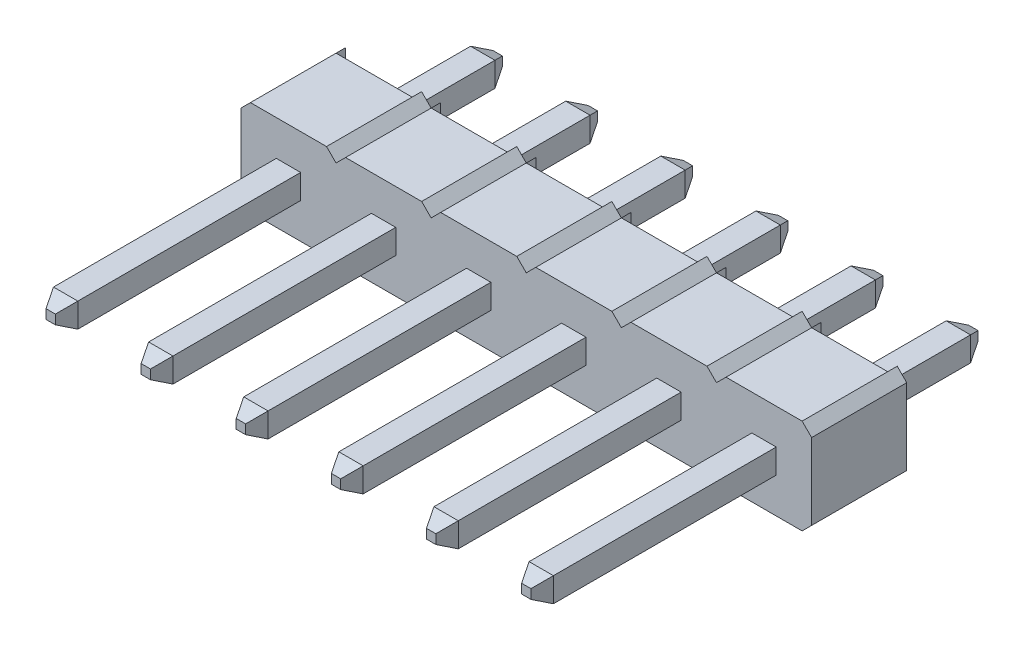
from build123d import *
from OCP.BRepFilletAPI import BRepFilletAPI_MakeChamfer

# Parameters (mm, degrees)
BOSS_EXTRUDE1_DEPTH  = 2.286
BOSS_EXTRUDE2_DEPTH  = 0.254
BOSS_EXTRUDE3_DEPTH  = 0.254
BOSS_EXTRUDE4_DEPTH  = 0.254
BOSS_EXTRUDE5_DEPTH  = 0.254
BOSS_EXTRUDE6_DEPTH  = 0.254
BOSS_EXTRUDE7_DEPTH  = 0.254
BOSS_EXTRUDE8_DEPTH  = 0.254
SKETCH9_W            = 0.65
SKETCH9_H            = 0.65
BOSS_EXTRUDE9_DEPTH  = 3.302
SKETCH10_W           = 0.65
SKETCH10_H           = 0.65
BOSS_EXTRUDE10_DEPTH = 6.35
SKETCH11_W           = 0.65
SKETCH11_H           = 0.65
BOSS_EXTRUDE11_DEPTH = 3.302
SKETCH12_W           = 0.65
SKETCH12_H           = 0.65
BOSS_EXTRUDE12_DEPTH = 6.35
SKETCH13_W           = 0.65
SKETCH13_H           = 0.65
BOSS_EXTRUDE13_DEPTH = 3.302
SKETCH14_W           = 0.65
SKETCH14_H           = 0.65
BOSS_EXTRUDE14_DEPTH = 6.35
SKETCH15_W           = 0.65
SKETCH15_H           = 0.65
BOSS_EXTRUDE15_DEPTH = 3.302
SKETCH16_W           = 0.65
SKETCH16_H           = 0.65
BOSS_EXTRUDE16_DEPTH = 6.35
SKETCH17_W           = 0.65
SKETCH17_H           = 0.65
BOSS_EXTRUDE17_DEPTH = 3.302
SKETCH18_W           = 0.65
SKETCH18_H           = 0.65
BOSS_EXTRUDE18_DEPTH = 6.35
SKETCH19_W           = 0.65
SKETCH19_H           = 0.65
BOSS_EXTRUDE19_DEPTH = 3.302
SKETCH20_W           = 0.65
SKETCH20_H           = 0.65
BOSS_EXTRUDE20_DEPTH = 6.35
CHAMFER1_SIZE        = 0.2
CHAMFER1_SIZE2       = 0.4


with BuildPart() as part:
    # Sketch1 → Boss-Extrude1 (new body)
    with BuildSketch(Plane.XY.offset(2.54)):
        Polygon((13.97, -1.016), (13.97, 1.016), (13.716, 1.27), (11.684, 1.27), (11.43, 1.016), (11.176, 1.27), (9.144, 1.27), (8.89, 1.016), (8.636, 1.27), (6.604, 1.27), (6.35, 1.016), (6.096, 1.27), (4.064, 1.27), (3.81, 1.016), (3.556, 1.27), (1.524, 1.27), (1.27, 1.016), (1.016, 1.27), (-1.016, 1.27), (-1.27, 1.016), (-1.27, -1.016), (-1.016, -1.27), (1.016, -1.27), (1.27, -1.016), (1.524, -1.27), (3.556, -1.27), (3.81, -1.016), (4.064, -1.27), (6.096, -1.27), (6.35, -1.016), (6.604, -1.27), (8.636, -1.27), (8.89, -1.016), (9.144, -1.27), (11.176, -1.27), (11.43, -1.016), (11.684, -1.27), (13.716, -1.27), align=None)
    extrude(amount=-BOSS_EXTRUDE1_DEPTH)

    # Sketch2 → Boss-Extrude2 (add)
    with BuildSketch(Plane(origin=(0, 0, 0.254), x_dir=(-1, 0, 0), z_dir=(0, 0, -1))):
        Polygon((-6.604, -1.27), (-6.604, 1.27), (-6.35, 1.016), (-6.096, 1.27), (-6.096, -1.27), (-6.35, -1.016), align=None)
    extrude(amount=BOSS_EXTRUDE2_DEPTH)

    # Sketch3 → Boss-Extrude3 (add)
    with BuildSketch(Plane(origin=(0, 0, 0.254), x_dir=(-1, 0, 0), z_dir=(0, 0, -1))):
        Polygon((-9.144, -1.27), (-9.144, 1.27), (-8.89, 1.016), (-8.636, 1.27), (-8.636, -1.27), (-8.89, -1.016), align=None)
    extrude(amount=BOSS_EXTRUDE3_DEPTH)

    # Sketch4 → Boss-Extrude4 (add)
    with BuildSketch(Plane(origin=(0, 0, 0.254), x_dir=(-1, 0, 0), z_dir=(0, 0, -1))):
        Polygon((-11.684, -1.27), (-11.684, 1.27), (-11.43, 1.016), (-11.176, 1.27), (-11.176, -1.27), (-11.43, -1.016), align=None)
    extrude(amount=BOSS_EXTRUDE4_DEPTH)

    # Sketch5 → Boss-Extrude5 (add)
    with BuildSketch(Plane(origin=(0, 0, 0.254), x_dir=(-1, 0, 0), z_dir=(0, 0, -1))):
        Polygon((-4.064, -1.27), (-4.064, 1.27), (-3.81, 1.016), (-3.556, 1.27), (-3.556, -1.27), (-3.81, -1.016), align=None)
    extrude(amount=BOSS_EXTRUDE5_DEPTH)

    # Sketch6 → Boss-Extrude6 (add)
    with BuildSketch(Plane(origin=(0, 0, 0.254), x_dir=(-1, 0, 0), z_dir=(0, 0, -1))):
        Polygon((-1.524, -1.27), (-1.524, 1.27), (-1.27, 1.016), (-1.016, 1.27), (-1.016, -1.27), (-1.27, -1.016), align=None)
    extrude(amount=BOSS_EXTRUDE6_DEPTH)

    # Sketch7 → Boss-Extrude7 (add)
    with BuildSketch(Plane(origin=(0, 0, 0.254), x_dir=(-1, 0, 0), z_dir=(0, 0, -1))):
        Polygon((1.016, -1.27), (1.016, 1.27), (1.27, 1.016), (1.27, -1.016), align=None)
    extrude(amount=BOSS_EXTRUDE7_DEPTH)

    # Sketch8 → Boss-Extrude8 (add)
    with BuildSketch(Plane(origin=(0, 0, 0.254), x_dir=(-1, 0, 0), z_dir=(0, 0, -1))):
        Polygon((-13.97, -1.016), (-13.97, 1.016), (-13.716, 1.27), (-13.716, -1.27), align=None)
    extrude(amount=BOSS_EXTRUDE8_DEPTH)

    # Sketch9 → Boss-Extrude9 (add)
    with BuildSketch(Plane(origin=(0, 0, 0.254), x_dir=(-1, 0, 0), z_dir=(0, 0, -1))):
        Rectangle(SKETCH9_W, SKETCH9_H)
    extrude(amount=BOSS_EXTRUDE9_DEPTH)

    # Sketch10 → Boss-Extrude10 (add)
    with BuildSketch(Plane.XY.offset(2.54)):
        Rectangle(SKETCH10_W, SKETCH10_H)
    extrude(amount=BOSS_EXTRUDE10_DEPTH)

    # Sketch11 → Boss-Extrude11 (add)
    with BuildSketch(Plane(origin=(0, 0, 0.254), x_dir=(-1, 0, 0), z_dir=(0, 0, -1))):
        with Locations((-12.7, 0)):
            Rectangle(SKETCH11_W, SKETCH11_H)
    extrude(amount=BOSS_EXTRUDE11_DEPTH)

    # Sketch12 → Boss-Extrude12 (add)
    with BuildSketch(Plane.XY.offset(2.54)):
        with Locations((12.7, 0)):
            Rectangle(SKETCH12_W, SKETCH12_H)
    extrude(amount=BOSS_EXTRUDE12_DEPTH)

    # Sketch13 → Boss-Extrude13 (add)
    with BuildSketch(Plane(origin=(0, 0, 0.254), x_dir=(-1, 0, 0), z_dir=(0, 0, -1))):
        with Locations((-10.16, 0)):
            Rectangle(SKETCH13_W, SKETCH13_H)
    extrude(amount=BOSS_EXTRUDE13_DEPTH)

    # Sketch14 → Boss-Extrude14 (add)
    with BuildSketch(Plane.XY.offset(2.54)):
        with Locations((10.16, 0)):
            Rectangle(SKETCH14_W, SKETCH14_H)
    extrude(amount=BOSS_EXTRUDE14_DEPTH)

    # Sketch15 → Boss-Extrude15 (add)
    with BuildSketch(Plane(origin=(0, 0, 0.254), x_dir=(-1, 0, 0), z_dir=(0, 0, -1))):
        with Locations((-7.62, 0)):
            Rectangle(SKETCH15_W, SKETCH15_H)
    extrude(amount=BOSS_EXTRUDE15_DEPTH)

    # Sketch16 → Boss-Extrude16 (add)
    with BuildSketch(Plane.XY.offset(2.54)):
        with Locations((7.62, 0)):
            Rectangle(SKETCH16_W, SKETCH16_H)
    extrude(amount=BOSS_EXTRUDE16_DEPTH)

    # Sketch17 → Boss-Extrude17 (add)
    with BuildSketch(Plane(origin=(0, 0, 0.254), x_dir=(-1, 0, 0), z_dir=(0, 0, -1))):
        with Locations((-5.08, 0)):
            Rectangle(SKETCH17_W, SKETCH17_H)
    extrude(amount=BOSS_EXTRUDE17_DEPTH)

    # Sketch18 → Boss-Extrude18 (add)
    with BuildSketch(Plane.XY.offset(2.54)):
        with Locations((5.08, 0)):
            Rectangle(SKETCH18_W, SKETCH18_H)
    extrude(amount=BOSS_EXTRUDE18_DEPTH)

    # Sketch19 → Boss-Extrude19 (add)
    with BuildSketch(Plane(origin=(0, 0, 0.254), x_dir=(-1, 0, 0), z_dir=(0, 0, -1))):
        with Locations((-2.54, 0)):
            Rectangle(SKETCH19_W, SKETCH19_H)
    extrude(amount=BOSS_EXTRUDE19_DEPTH)

    # Sketch20 → Boss-Extrude20 (add)
    with BuildSketch(Plane.XY.offset(2.54)):
        with Locations((2.54, 0)):
            Rectangle(SKETCH20_W, SKETCH20_H)
    extrude(amount=BOSS_EXTRUDE20_DEPTH)

    # Chamfer1: one chamfer whose edges measure the first distance from different faces: ONE call of the kernel's chamfer builder (chamfer() names one face for all edges)
    chamfer1_edges_1 = [part.edges().sort_by_distance(p)[0] for p in [
        (0, 0.325, -3.048),
        (0.325, 0, -3.048),
        (0, -0.325, -3.048),
        (-0.325, 0, -3.048),
    ]]
    chamfer1_side_1 = [part.faces().sort_by_distance(p)[0] for p in [
        (0, 0, -3.048),
    ]]
    chamfer1_edges_2 = [part.edges().sort_by_distance(p)[0] for p in [
        (0, -0.325, 8.89),
        (0.325, 0, 8.89),
        (0, 0.325, 8.89),
        (-0.325, 0, 8.89),
    ]]
    chamfer1_side_2 = [part.faces().sort_by_distance(p)[0] for p in [
        (0, 0, 8.89),
    ]]
    chamfer1_edges_3 = [part.edges().sort_by_distance(p)[0] for p in [
        (12.375, 0, -3.048),
        (12.7, 0.325, -3.048),
        (13.025, 0, -3.048),
        (12.7, -0.325, -3.048),
    ]]
    chamfer1_side_3 = [part.faces().sort_by_distance(p)[0] for p in [
        (12.7, 0, -3.048),
    ]]
    chamfer1_edges_4 = [part.edges().sort_by_distance(p)[0] for p in [
        (12.7, -0.325, 8.89),
        (13.025, 0, 8.89),
        (12.7, 0.325, 8.89),
        (12.375, 0, 8.89),
    ]]
    chamfer1_side_4 = [part.faces().sort_by_distance(p)[0] for p in [
        (12.7, 0, 8.89),
    ]]
    chamfer1_edges_5 = [part.edges().sort_by_distance(p)[0] for p in [
        (9.835, 0, -3.048),
        (10.16, 0.325, -3.048),
        (10.485, 0, -3.048),
        (10.16, -0.325, -3.048),
    ]]
    chamfer1_side_5 = [part.faces().sort_by_distance(p)[0] for p in [
        (10.16, 0, -3.048),
    ]]
    chamfer1_edges_6 = [part.edges().sort_by_distance(p)[0] for p in [
        (10.16, -0.325, 8.89),
        (10.485, 0, 8.89),
        (10.16, 0.325, 8.89),
        (9.835, 0, 8.89),
    ]]
    chamfer1_side_6 = [part.faces().sort_by_distance(p)[0] for p in [
        (10.16, 0, 8.89),
    ]]
    chamfer1_edges_7 = [part.edges().sort_by_distance(p)[0] for p in [
        (7.945, 0, -3.048),
        (7.62, -0.325, -3.048),
        (7.295, 0, -3.048),
        (7.62, 0.325, -3.048),
    ]]
    chamfer1_side_7 = [part.faces().sort_by_distance(p)[0] for p in [
        (7.62, 0, -3.048),
    ]]
    chamfer1_edges_8 = [part.edges().sort_by_distance(p)[0] for p in [
        (7.62, 0.325, 8.89),
        (7.295, 0, 8.89),
        (7.62, -0.325, 8.89),
        (7.945, 0, 8.89),
    ]]
    chamfer1_side_8 = [part.faces().sort_by_distance(p)[0] for p in [
        (7.62, 0, 8.89),
    ]]
    chamfer1_edges_9 = [part.edges().sort_by_distance(p)[0] for p in [
        (5.405, 0, -3.048),
        (5.08, -0.325, -3.048),
        (4.755, 0, -3.048),
        (5.08, 0.325, -3.048),
    ]]
    chamfer1_side_9 = [part.faces().sort_by_distance(p)[0] for p in [
        (5.08, 0, -3.048),
    ]]
    chamfer1_edges_10 = [part.edges().sort_by_distance(p)[0] for p in [
        (5.08, 0.325, 8.89),
        (4.755, 0, 8.89),
        (5.08, -0.325, 8.89),
        (5.405, 0, 8.89),
    ]]
    chamfer1_side_10 = [part.faces().sort_by_distance(p)[0] for p in [
        (5.08, 0, 8.89),
    ]]
    chamfer1_edges_11 = [part.edges().sort_by_distance(p)[0] for p in [
        (2.865, 0, -3.048),
        (2.54, -0.325, -3.048),
        (2.215, 0, -3.048),
        (2.54, 0.325, -3.048),
    ]]
    chamfer1_side_11 = [part.faces().sort_by_distance(p)[0] for p in [
        (2.54, 0, -3.048),
    ]]
    chamfer1_edges_12 = [part.edges().sort_by_distance(p)[0] for p in [
        (2.54, 0.325, 8.89),
        (2.215, 0, 8.89),
        (2.54, -0.325, 8.89),
        (2.865, 0, 8.89),
    ]]
    chamfer1_side_12 = [part.faces().sort_by_distance(p)[0] for p in [
        (2.54, 0, 8.89),
    ]]
    chamfer1 = BRepFilletAPI_MakeChamfer(part.part.solid().wrapped)
    for e in chamfer1_edges_1:
        chamfer1.Add(CHAMFER1_SIZE, CHAMFER1_SIZE2, e.wrapped, chamfer1_side_1[0].wrapped)  # the first distance lies on this face
    for e in chamfer1_edges_2:
        chamfer1.Add(CHAMFER1_SIZE, CHAMFER1_SIZE2, e.wrapped, chamfer1_side_2[0].wrapped)  # the first distance lies on this face
    for e in chamfer1_edges_3:
        chamfer1.Add(CHAMFER1_SIZE, CHAMFER1_SIZE2, e.wrapped, chamfer1_side_3[0].wrapped)  # the first distance lies on this face
    for e in chamfer1_edges_4:
        chamfer1.Add(CHAMFER1_SIZE, CHAMFER1_SIZE2, e.wrapped, chamfer1_side_4[0].wrapped)  # the first distance lies on this face
    for e in chamfer1_edges_5:
        chamfer1.Add(CHAMFER1_SIZE, CHAMFER1_SIZE2, e.wrapped, chamfer1_side_5[0].wrapped)  # the first distance lies on this face
    for e in chamfer1_edges_6:
        chamfer1.Add(CHAMFER1_SIZE, CHAMFER1_SIZE2, e.wrapped, chamfer1_side_6[0].wrapped)  # the first distance lies on this face
    for e in chamfer1_edges_7:
        chamfer1.Add(CHAMFER1_SIZE, CHAMFER1_SIZE2, e.wrapped, chamfer1_side_7[0].wrapped)  # the first distance lies on this face
    for e in chamfer1_edges_8:
        chamfer1.Add(CHAMFER1_SIZE, CHAMFER1_SIZE2, e.wrapped, chamfer1_side_8[0].wrapped)  # the first distance lies on this face
    for e in chamfer1_edges_9:
        chamfer1.Add(CHAMFER1_SIZE, CHAMFER1_SIZE2, e.wrapped, chamfer1_side_9[0].wrapped)  # the first distance lies on this face
    for e in chamfer1_edges_10:
        chamfer1.Add(CHAMFER1_SIZE, CHAMFER1_SIZE2, e.wrapped, chamfer1_side_10[0].wrapped)  # the first distance lies on this face
    for e in chamfer1_edges_11:
        chamfer1.Add(CHAMFER1_SIZE, CHAMFER1_SIZE2, e.wrapped, chamfer1_side_11[0].wrapped)  # the first distance lies on this face
    for e in chamfer1_edges_12:
        chamfer1.Add(CHAMFER1_SIZE, CHAMFER1_SIZE2, e.wrapped, chamfer1_side_12[0].wrapped)  # the first distance lies on this face
    add(Compound.cast(chamfer1.Shape()), mode=Mode.REPLACE)


solid = part.part
